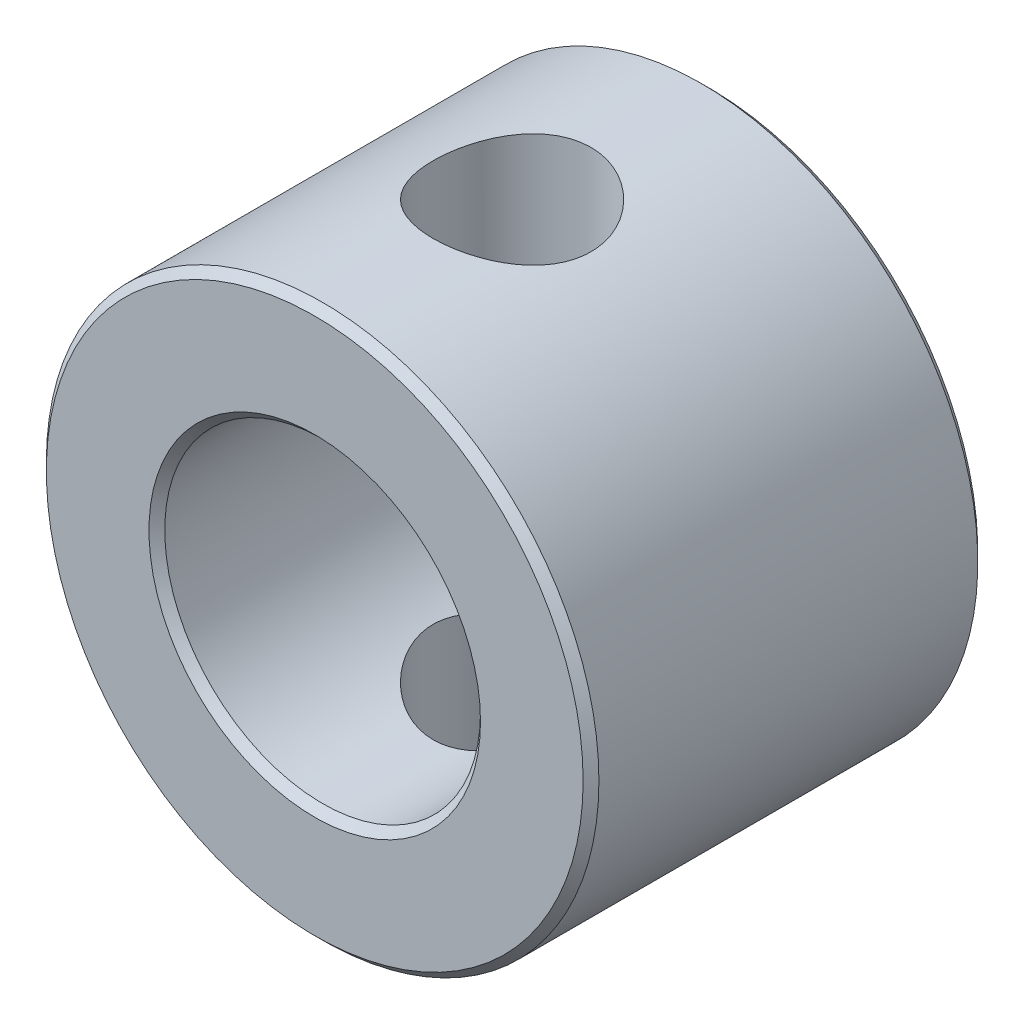
from build123d import *

# Parameters (mm, degrees)
SKETCH1_W                    = 7
SKETCH1_H                    = 10
F_8_0_8_DIAMETER_HOLE1_D     = 8
F_4_0_4_DIAMETER_HOLE1_D     = 4
F_4_0_4_DIAMETER_HOLE1_DEPTH = 17.535898385
CHAMFER1_SIZE                = 0.2


with BuildPart() as part:
    # Sketch1 → Revolve1 (revolve)
    with BuildSketch(Plane.XZ, mode=Mode.PRIVATE) as revolve1_sk:
        with Locations((3.5, 5)):
            Rectangle(SKETCH1_W, SKETCH1_H)
    revolve(revolve1_sk.sketch.rotate(Axis((0, 0, 10), (0, 0, -1)), 180), axis=Axis((0, 0, 10), (0, 0, -1)))

    # Ø8.0 (8) Diameter Hole1 (through all)
    with Locations(Plane.XY.offset(10)):
        with Locations((0, 0)):
            Hole(F_8_0_8_DIAMETER_HOLE1_D / 2)

    # Ø4.0 (4) Diameter Hole1
    with Locations(Plane(origin=(0, 7, 5), x_dir=(1, 0, 0), z_dir=(0, 1, 0))):
        with Locations((0, 0)):
            Hole(F_4_0_4_DIAMETER_HOLE1_D / 2, depth=F_4_0_4_DIAMETER_HOLE1_DEPTH)

    # Chamfer1
    chamfer1_edges = [part.edges().sort_by_distance(p)[0] for p in [
        (4, 0, 10),
        (4, 0, 0),
        (7, 0, 0),
        (7, 0, 10),
    ]]
    chamfer(chamfer1_edges, length=CHAMFER1_SIZE)


solid = part.part
